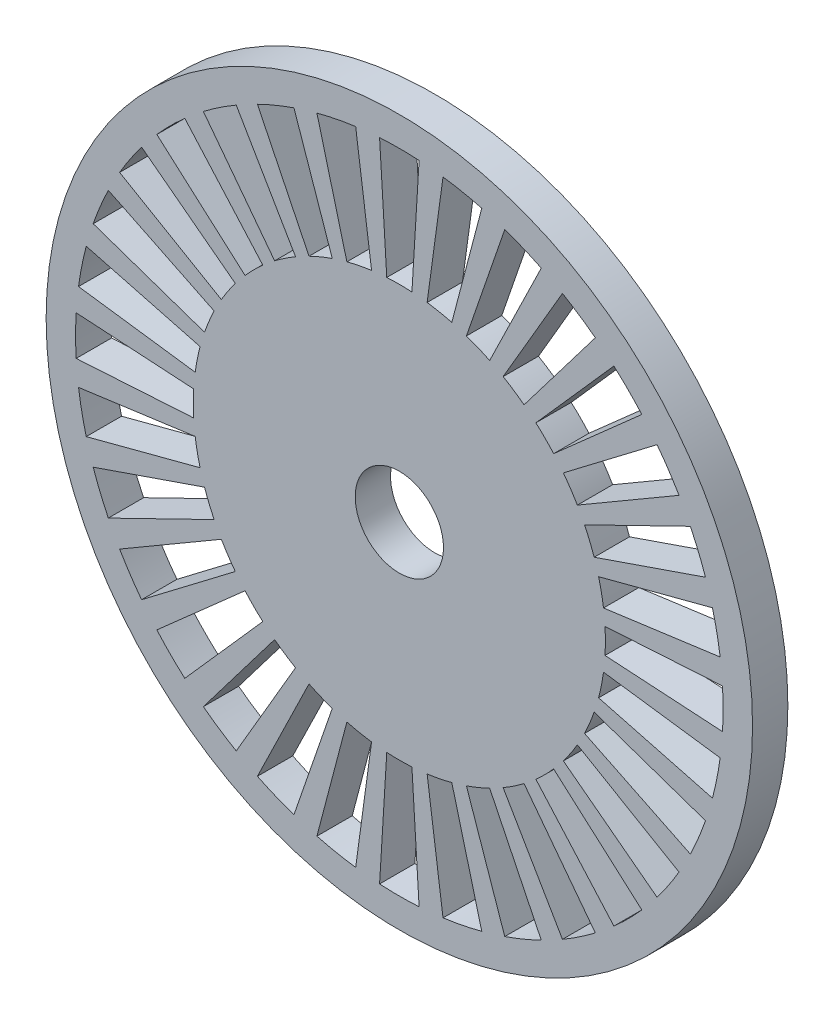
from build123d import *

# Parameters (mm, degrees)
SKETCH2_R           = 12
SKETCH2_R_2         = 1.5
BOSS_EXTRUDE1_DEPTH = 1.2
CUT_EXTRUDE1_DEPTH  = 1.2
CIRPATTERN1_COUNT   = 32


with BuildPart() as part:
    # Sketch2 → Boss-Extrude1 (new body)
    with BuildSketch(Plane.XY):
        Circle(SKETCH2_R)
        Circle(SKETCH2_R_2, mode=Mode.SUBTRACT)
    extrude(amount=BOSS_EXTRUDE1_DEPTH)

    # Sketch3 → Cut-Extrude1 (cut)
    with BuildSketch(Plane.XY.offset(1.2)):
        with BuildLine():
            ThreePointArc((-0.427339777, 6.986943589), (-0.213769592, 6.996735136), (0, 7))
            Line((0, 7), (0, 11))
            ThreePointArc((0, 11), (-0.335923645, 10.994869499), (-0.671533935, 10.979482783))
            Line((-0.671533935, 10.979482783), (-0.427339777, 6.986943589))
        make_face()
        with BuildLine():
            Line((0, 11), (0, 7))
            ThreePointArc((0, 7), (0.213769592, 6.996735136), (0.427339777, 6.986943589))
            Line((0.427339777, 6.986943589), (0.671533935, 10.979482783))
            ThreePointArc((0.671533935, 10.979482783), (0.335923645, 10.994869499), (0, 11))
        make_face()
    cut_extrude1 = extrude(amount=-CUT_EXTRUDE1_DEPTH, mode=Mode.SUBTRACT)

    # CirPattern1: Cut-Extrude1 ×32 about axis
    cirpattern1_axis = Axis((0, 0, 0), (0, 0, 1))
    for i in range(1, CIRPATTERN1_COUNT):
        add(cut_extrude1.rotate(cirpattern1_axis, i * 360 / CIRPATTERN1_COUNT), mode=Mode.SUBTRACT)


solid = part.part
